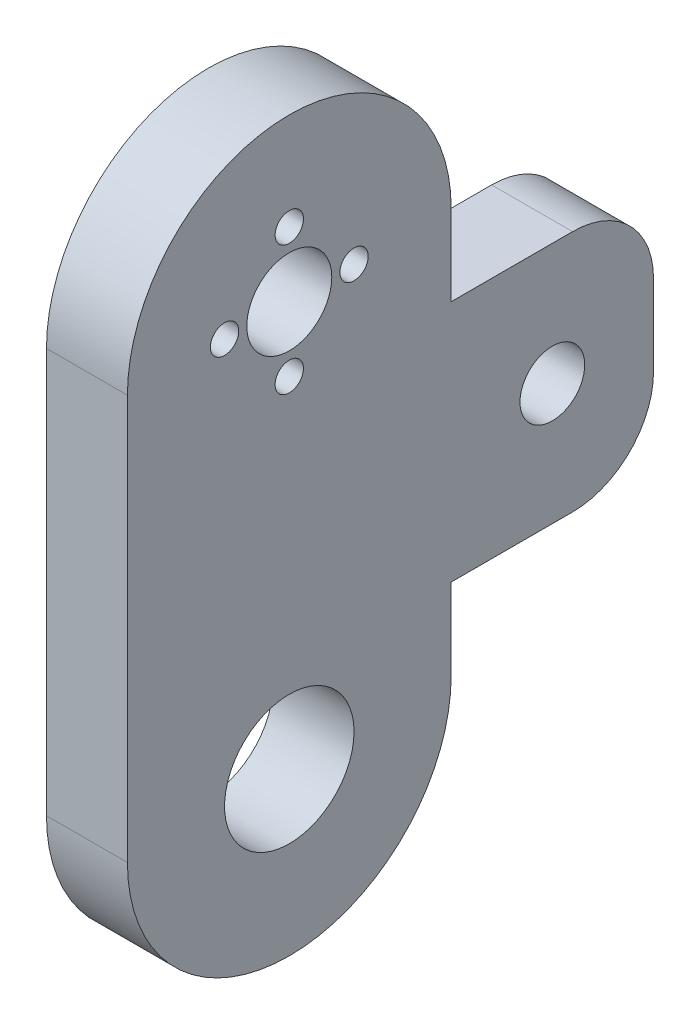
from build123d import *

# Parameters (mm, degrees)
CROQUIS1_R              = 5.25
CROQUIS1_R_2            = 8
CROQUIS1_R_3            = 1.75
CROQUIS1_R_4            = 4
SALIENTE_EXTRUIR1_DEPTH = 10


with BuildPart() as part:
    # Croquis1 → Saliente-Extruir1 (new body)
    with BuildSketch(Plane(origin=(0, 0, 0), x_dir=(0, 0, -1), z_dir=(1, 0, 0))):
        with BuildLine():
            Line((20, 15), (20, 25))
            ThreePointArc((20, 25), (0, 45), (-20, 25))
            Line((-20, 25), (-20, -25))
            ThreePointArc((-20, -25), (0, -45), (20, -25))
            Line((20, -25), (20, -15))
            Line((20, -15), (35, -15))
            ThreePointArc((35, -15), (42.071067812, -12.071067812), (45, -5))
            Line((45, -5), (45, 5))
            ThreePointArc((45, 5), (42.071067812, 12.071067812), (35, 15))
            Line((35, 15), (20, 15))
        make_face()
        with Locations((0, 25)):
            Circle(CROQUIS1_R, mode=Mode.SUBTRACT)
        with Locations((0, -25)):
            Circle(CROQUIS1_R_2, mode=Mode.SUBTRACT)
        with Locations((0, 33)):
            Circle(CROQUIS1_R_3, mode=Mode.SUBTRACT)
        with Locations((8, 25)):
            Circle(CROQUIS1_R_3, mode=Mode.SUBTRACT)
        with Locations((0, 17)):
            Circle(CROQUIS1_R_3, mode=Mode.SUBTRACT)
        with Locations((-8, 25)):
            Circle(CROQUIS1_R_3, mode=Mode.SUBTRACT)
        with Locations((32.5, 0)):
            Circle(CROQUIS1_R_4, mode=Mode.SUBTRACT)
    extrude(amount=SALIENTE_EXTRUIR1_DEPTH)


solid = part.part
